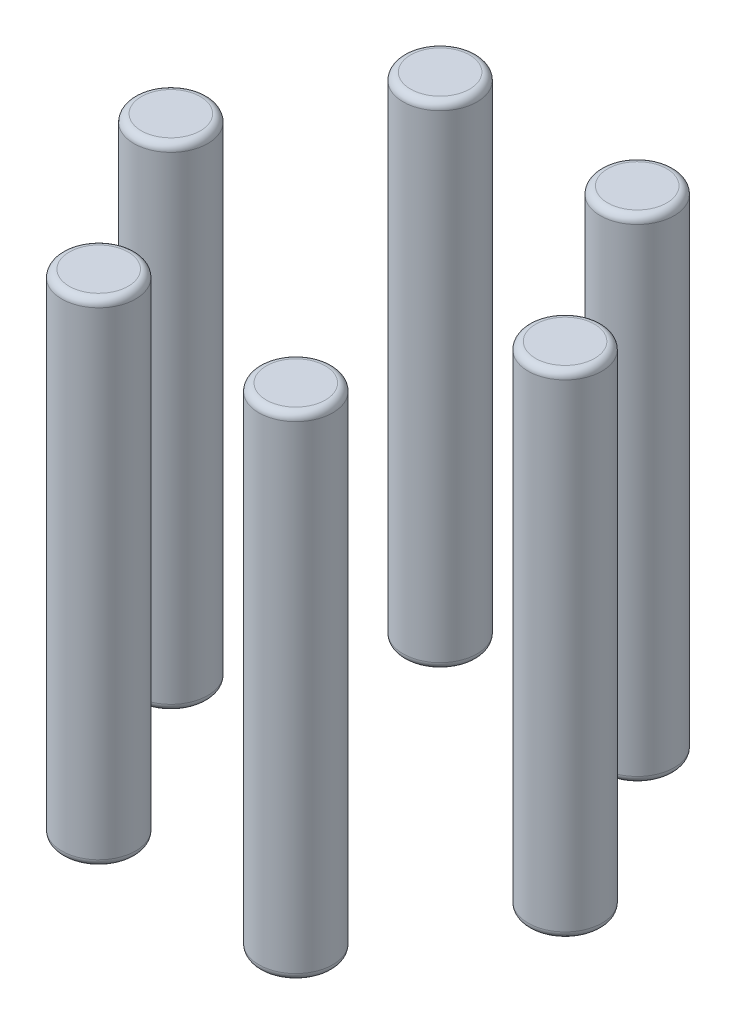
from build123d import *

# Parameters (mm, degrees)
BOSS_EXTRUDE1_DEPTH        = 14
BOSS_EXTRUDE1_DEPTH_BACK   = 6
SKETCH2_R                  = 1.5
BOSS_EXTRUDE1_2_DEPTH      = 14
BOSS_EXTRUDE1_2_DEPTH_BACK = 6
BOSS_EXTRUDE1_3_DEPTH      = 14
BOSS_EXTRUDE1_3_DEPTH_BACK = 6
BOSS_EXTRUDE1_4_DEPTH      = 14
BOSS_EXTRUDE1_4_DEPTH_BACK = 6
BOSS_EXTRUDE1_5_DEPTH      = 14
BOSS_EXTRUDE1_5_DEPTH_BACK = 6
BOSS_EXTRUDE1_6_DEPTH      = 14
BOSS_EXTRUDE1_6_DEPTH_BACK = 6
FILLET1_R                  = 0.3
FILLET2_R                  = 0.3
FILLET3_R                  = 0.3
FILLET4_R                  = 0.3
FILLET5_R                  = 0.3
FILLET6_R                  = 0.3
FILLET7_R                  = 0.3
FILLET8_R                  = 0.3
FILLET9_R                  = 0.3
FILLET10_R                 = 0.3
FILLET11_R                 = 0.3
FILLET12_R                 = 0.3


with BuildPart() as part:
    # Sketch2 → Boss-Extrude1 (new, two sides: drawn at the far end of the back side and taken through both)
    with BuildSketch(Plane(origin=(0, 0, 0), x_dir=(1, 0, 0), z_dir=(0, 1, 0)).offset(-BOSS_EXTRUDE1_DEPTH_BACK)):
        with Locations(Location((7.5, 1.13e-07, 0), (0, 0, 270))):
            Circle(SKETCH2_R)
    extrude(amount=BOSS_EXTRUDE1_DEPTH + BOSS_EXTRUDE1_DEPTH_BACK)

    # Fillet4
    fillet4_edges = [part.edges().sort_by_distance(p)[0] for p in [
        (7.5, 14, -1.500000113),
    ]]
    fillet(fillet4_edges, radius=FILLET4_R)

    # Fillet12
    fillet12_edges = [part.edges().sort_by_distance(p)[0] for p in [
        (7.5, -6, -1.500000113),
    ]]
    fillet(fillet12_edges, radius=FILLET12_R)


with BuildPart() as body_2:
    # Sketch2 → Boss-Extrude1 2 (new, two sides: drawn at the far end of the back side and taken through both)
    with BuildSketch(Plane(origin=(0, 0, 0), x_dir=(1, 0, 0), z_dir=(0, 1, 0)).offset(-BOSS_EXTRUDE1_2_DEPTH_BACK)):
        with Locations(Location((3.5, -6.928203117, 0), (0, 0, 270))):
            Circle(SKETCH2_R)
    extrude(amount=BOSS_EXTRUDE1_2_DEPTH + BOSS_EXTRUDE1_2_DEPTH_BACK)

    # Fillet5
    fillet5_edges = [body_2.edges().sort_by_distance(p)[0] for p in [
        (3.5, 14, 5.428203117),
    ]]
    fillet(fillet5_edges, radius=FILLET5_R)

    # Fillet8
    fillet8_edges = [body_2.edges().sort_by_distance(p)[0] for p in [
        (3.5, -6, 5.428203117),
    ]]
    fillet(fillet8_edges, radius=FILLET8_R)


with BuildPart() as body_3:
    # Sketch2 → Boss-Extrude1 3 (new, two sides: drawn at the far end of the back side and taken through both)
    with BuildSketch(Plane(origin=(0, 0, 0), x_dir=(1, 0, 0), z_dir=(0, 1, 0)).offset(-BOSS_EXTRUDE1_3_DEPTH_BACK)):
        with Locations(Location((-4.5, -6.928203117, 0), (0, 0, 270))):
            Circle(SKETCH2_R)
    extrude(amount=BOSS_EXTRUDE1_3_DEPTH + BOSS_EXTRUDE1_3_DEPTH_BACK)

    # Fillet6
    fillet6_edges = [body_3.edges().sort_by_distance(p)[0] for p in [
        (-4.5, 14, 5.428203117),
    ]]
    fillet(fillet6_edges, radius=FILLET6_R)

    # Fillet7
    fillet7_edges = [body_3.edges().sort_by_distance(p)[0] for p in [
        (-4.5, -6, 5.428203117),
    ]]
    fillet(fillet7_edges, radius=FILLET7_R)


with BuildPart() as body_4:
    # Sketch2 → Boss-Extrude1 4 (new, two sides: drawn at the far end of the back side and taken through both)
    with BuildSketch(Plane(origin=(0, 0, 0), x_dir=(1, 0, 0), z_dir=(0, 1, 0)).offset(-BOSS_EXTRUDE1_4_DEPTH_BACK)):
        with Locations(Location((-8.5, 1.13e-07, 0), (0, 0, 270))):
            Circle(SKETCH2_R)
    extrude(amount=BOSS_EXTRUDE1_4_DEPTH + BOSS_EXTRUDE1_4_DEPTH_BACK)

    # Fillet1
    fillet1_edges = [body_4.edges().sort_by_distance(p)[0] for p in [
        (-8.5, 14, -1.500000113),
    ]]
    fillet(fillet1_edges, radius=FILLET1_R)

    # Fillet9
    fillet9_edges = [body_4.edges().sort_by_distance(p)[0] for p in [
        (-8.5, -6, -1.500000113),
    ]]
    fillet(fillet9_edges, radius=FILLET9_R)


with BuildPart() as body_5:
    # Sketch2 → Boss-Extrude1 5 (new, two sides: drawn at the far end of the back side and taken through both)
    with BuildSketch(Plane(origin=(0, 0, 0), x_dir=(1, 0, 0), z_dir=(0, 1, 0)).offset(-BOSS_EXTRUDE1_5_DEPTH_BACK)):
        with Locations(Location((-4.5, 6.928203343, 0), (0, 0, 270))):
            Circle(SKETCH2_R)
    extrude(amount=BOSS_EXTRUDE1_5_DEPTH + BOSS_EXTRUDE1_5_DEPTH_BACK)

    # Fillet2
    fillet2_edges = [body_5.edges().sort_by_distance(p)[0] for p in [
        (-4.5, 14, -8.428203343),
    ]]
    fillet(fillet2_edges, radius=FILLET2_R)

    # Fillet10
    fillet10_edges = [body_5.edges().sort_by_distance(p)[0] for p in [
        (-4.5, -6, -8.428203343),
    ]]
    fillet(fillet10_edges, radius=FILLET10_R)


with BuildPart() as body_6:
    # Sketch2 → Boss-Extrude1 6 (new, two sides: drawn at the far end of the back side and taken through both)
    with BuildSketch(Plane(origin=(0, 0, 0), x_dir=(1, 0, 0), z_dir=(0, 1, 0)).offset(-BOSS_EXTRUDE1_6_DEPTH_BACK)):
        with Locations(Location((3.5, 6.928203343, 0), (0, 0, 270))):
            Circle(SKETCH2_R)
    extrude(amount=BOSS_EXTRUDE1_6_DEPTH + BOSS_EXTRUDE1_6_DEPTH_BACK)

    # Fillet3
    fillet3_edges = [body_6.edges().sort_by_distance(p)[0] for p in [
        (3.5, 14, -8.428203343),
    ]]
    fillet(fillet3_edges, radius=FILLET3_R)

    # Fillet11
    fillet11_edges = [body_6.edges().sort_by_distance(p)[0] for p in [
        (3.5, -6, -8.428203343),
    ]]
    fillet(fillet11_edges, radius=FILLET11_R)


solid = Compound([part.part, body_2.part, body_3.part, body_4.part, body_5.part, body_6.part])
